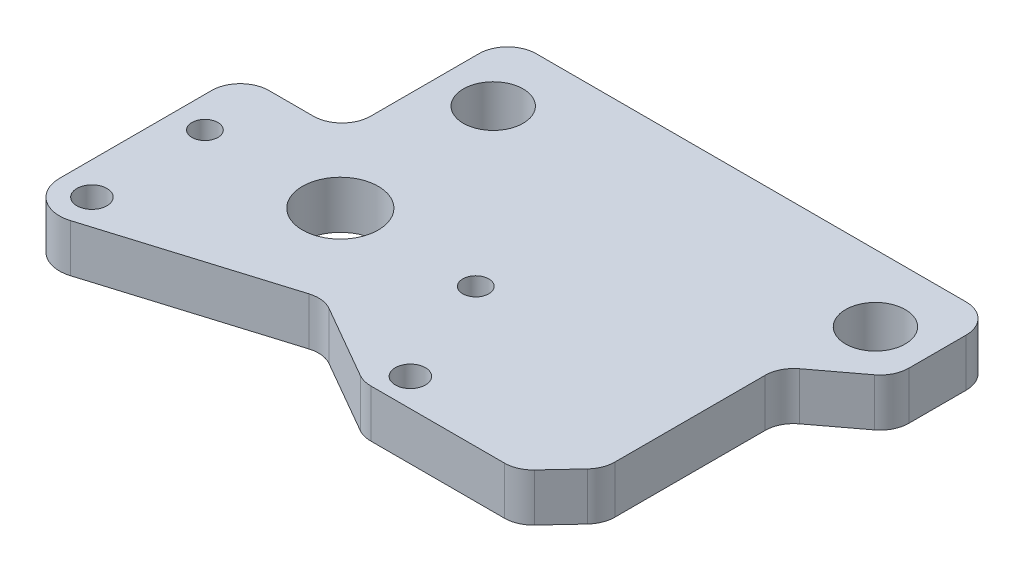
from build123d import *

# Parameters (mm, degrees)
SKETCH4_R           = 5.04
SKETCH4_R_2         = 3.96875
SKETCH4_R_3         = 2
SKETCH4_R_4         = 1.7272
BOSS_EXTRUDE2_DEPTH = 6.35


with BuildPart() as part:
    # Sketch4 → Boss-Extrude2 (new body)
    with BuildSketch(Plane(origin=(0, 0, 0), x_dir=(1, 0, 0), z_dir=(0, 1, 0))):
        with BuildLine():
            Line((40.257702493, -18.4375), (22.483900583, -18.4375))
            ThreePointArc((22.483900583, -18.4375), (21.500464498, -18.308390309), (20.583679925, -17.929811531))
            Line((20.583679925, -17.929811531), (10.779476649, -12.288263354))
            ThreePointArc((10.779476649, -12.288263354), (9.307944036, -11.804768953), (7.765559219, -11.946980575))
            Line((7.765559219, -11.946980575), (-16.517810325, -19.369406885))
            ThreePointArc((-16.517810325, -19.369406885), (-20.348558836, -18.710969534), (-22.098, -15.24))
            Line((-22.098, -15.24), (-22.098, 4.987500122))
            ThreePointArc((-22.098, 4.987500122), (-20.982076836, 7.681576958), (-18.288, 8.797500122))
            Line((-18.288, 8.797500122), (-12.3825, 8.797500122))
            ThreePointArc((-12.3825, 8.797500122), (-9.688423164, 9.913423286), (-8.5725, 12.607500122))
            Line((-8.5725, 12.607500122), (-8.5725, 26.9875))
            ThreePointArc((-8.5725, 26.9875), (-7.456576836, 29.681576836), (-4.7625, 30.7975))
            Line((-4.7625, 30.7975), (52.3875, 30.7975))
            ThreePointArc((52.3875, 30.7975), (55.081576836, 29.681576836), (56.1975, 26.9875))
            Line((56.1975, 26.9875), (56.1975, 19.362095927))
            ThreePointArc((56.1975, 19.362095927), (55.797199918, 17.662082259), (54.680415238, 16.319294633))
            Line((54.680415238, 16.319294633), (48.985566477, 12.027918285))
            ThreePointArc((48.985566477, 12.027918285), (47.868781798, 10.685130659), (47.468481715, 8.985116992))
            Line((47.468481715, 8.985116992), (47.468481715, -10.980610773))
            ThreePointArc((47.468481715, -10.980610773), (47.203372649, -12.376980446), (46.444939319, -13.579024524))
            Line((46.444939319, -13.579024524), (43.044160097, -17.225913752))
            ThreePointArc((43.044160097, -17.225913752), (41.776936446, -18.121498883), (40.257702493, -18.4375))
        make_face()
        with Locations(Location((0, 0, 0), (0, 0, 270))):
            Circle(SKETCH4_R, mode=Mode.SUBTRACT)
        with Locations(Location((-1.5875, 21.9075, 0), (0, 0, 270))):
            Circle(SKETCH4_R_2, mode=Mode.SUBTRACT)
        with Locations(Location((49.2125, 21.9075, 0), (0, 0, 270))):
            Circle(SKETCH4_R_2, mode=Mode.SUBTRACT)
        with Locations(Location((24.012521227, -14.703599027, 0), (0, 0, 270))):
            Circle(SKETCH4_R_3, mode=Mode.SUBTRACT)
        with Locations(Location((-17.78, -15.24, 0), (0, 0, 270))):
            Circle(SKETCH4_R_3, mode=Mode.SUBTRACT)
        with Locations(Location((18.000000004, 0, 0), (0, 0, 270))):
            Circle(SKETCH4_R_4, mode=Mode.SUBTRACT)
        with Locations(Location((-18.000000004, 0, 0), (0, 0, 270))):
            Circle(SKETCH4_R_4, mode=Mode.SUBTRACT)
    extrude(amount=-BOSS_EXTRUDE2_DEPTH)


solid = part.part
